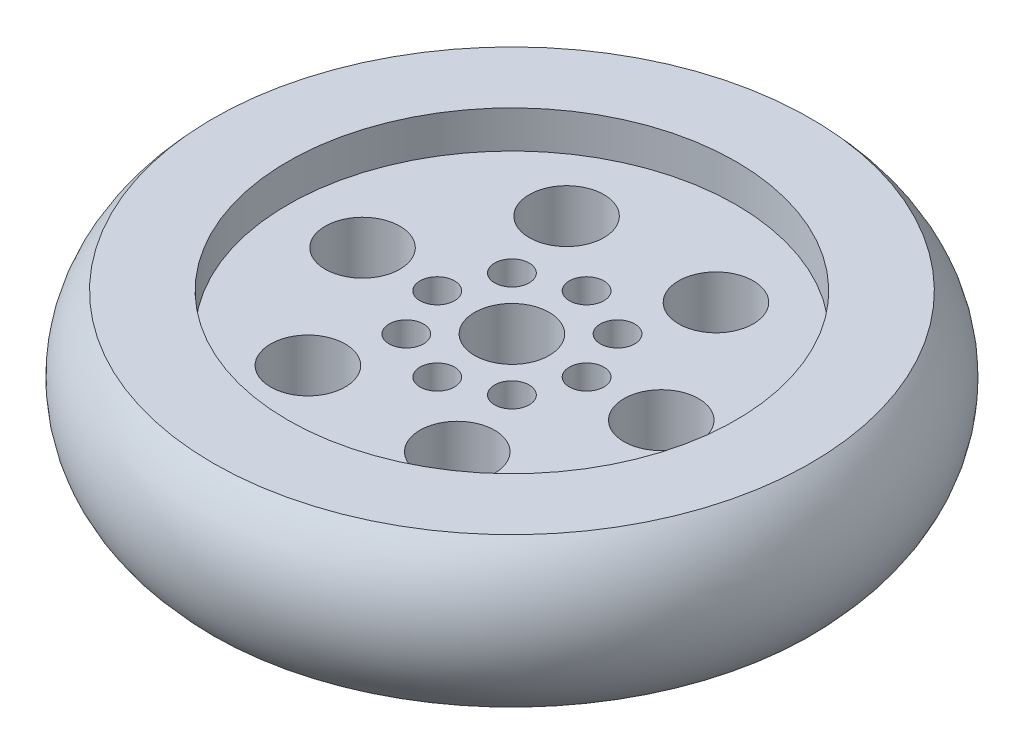
from build123d import *

# Parameters (mm, degrees)
SKETCH_1_R              = 24
SKETCH_1_R_2            = 4
SKETCH_1_R_3            = 1.85
WHEEL_HUB_TAP_DEPTH     = 4
SKETCH_1_3_R            = 32
SKETCH_1_3_R_2          = 24
WHEEL_HUB_OUTSIDE_DEPTH = 8


with BuildPart() as part:
    # 草图1 → wheel hub tap (new, symmetric)
    with BuildSketch(Plane(origin=(0, 0, 0), x_dir=(1, 0, 0), z_dir=(0, 1, 0))):
        Circle(SKETCH_1_R)
        with Locations((-8, -13.856406461)):
            Circle(SKETCH_1_R_2, mode=Mode.SUBTRACT)
        with Locations((-5.656854249, -5.656854249)):
            Circle(SKETCH_1_R_3, mode=Mode.SUBTRACT)
        with Locations((0, -8)):
            Circle(SKETCH_1_R_3, mode=Mode.SUBTRACT)
        with Locations((8, -13.856406461)):
            Circle(SKETCH_1_R_2, mode=Mode.SUBTRACT)
        with Locations((5.656854249, -5.656854249)):
            Circle(SKETCH_1_R_3, mode=Mode.SUBTRACT)
        with Locations((-16, 0)):
            Circle(SKETCH_1_R_2, mode=Mode.SUBTRACT)
        with Locations((-8, 0)):
            Circle(SKETCH_1_R_3, mode=Mode.SUBTRACT)
        with Locations((-5.656854249, 5.656854249)):
            Circle(SKETCH_1_R_3, mode=Mode.SUBTRACT)
        with Locations((-8, 13.856406461)):
            Circle(SKETCH_1_R_2, mode=Mode.SUBTRACT)
        Circle(SKETCH_1_R_2, mode=Mode.SUBTRACT)
        with Locations((5.656854249, 5.656854249)):
            Circle(SKETCH_1_R_3, mode=Mode.SUBTRACT)
        with Locations((8, 0)):
            Circle(SKETCH_1_R_3, mode=Mode.SUBTRACT)
        with Locations((0, 8)):
            Circle(SKETCH_1_R_3, mode=Mode.SUBTRACT)
        with Locations((8, 13.856406461)):
            Circle(SKETCH_1_R_2, mode=Mode.SUBTRACT)
        with Locations((16, 0)):
            Circle(SKETCH_1_R_2, mode=Mode.SUBTRACT)
    extrude(amount=WHEEL_HUB_TAP_DEPTH, both=True)


with BuildPart() as body_2:
    # 草图1<3> → wheel hub outside (new, symmetric)
    with BuildSketch(Plane(origin=(0, 0, 0), x_dir=(1, 0, 0), z_dir=(0, 1, 0))):
        Circle(SKETCH_1_3_R)
        Circle(SKETCH_1_3_R_2, mode=Mode.SUBTRACT)
    extrude(amount=WHEEL_HUB_OUTSIDE_DEPTH, both=True)


with BuildPart() as body_3:
    # 草图2 → rubber tyre (revolve)
    with BuildSketch(Plane(origin=(0, 0, 0), x_dir=(0, 0, -1), z_dir=(1, 0, 0))):
        with BuildLine():
            Line((32, 8), (32, -8))
            ThreePointArc((32, -8), (35.313708499, 0), (32, 8))
        make_face()
    revolve(axis=Axis((0, 67.110243395, 0), (0, -1, 0)))


solid = Compound([part.part, body_2.part, body_3.part])
